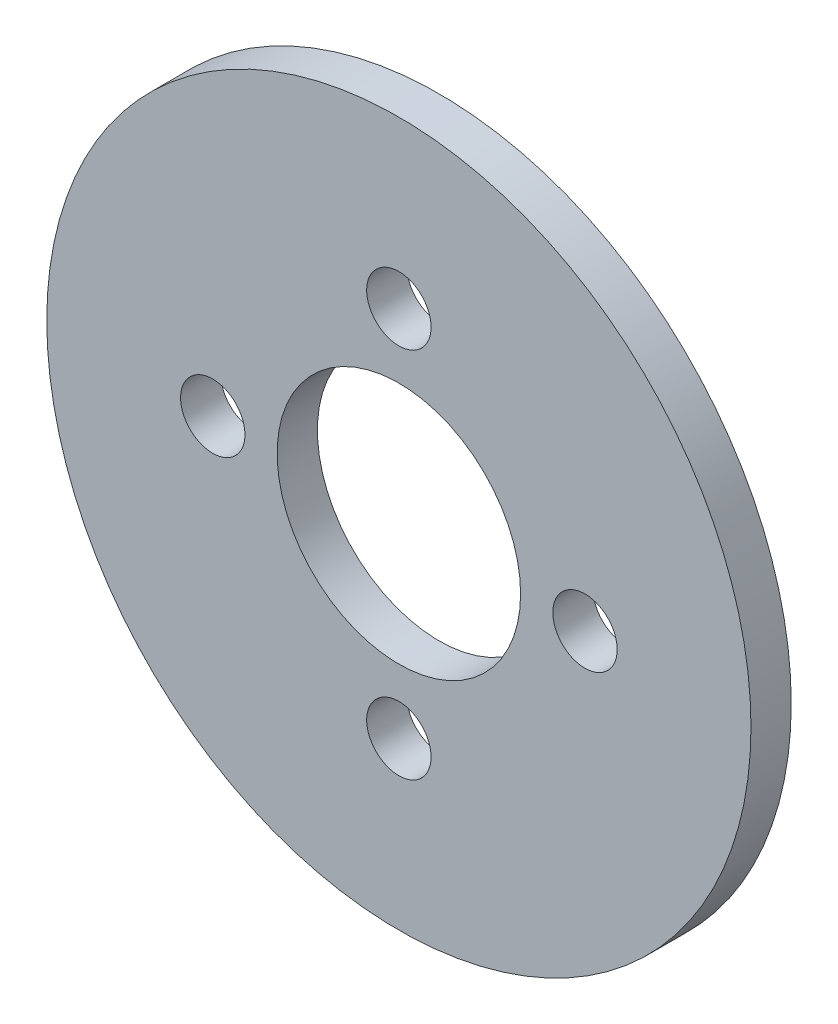
from build123d import *

# Parameters (mm, degrees)
SKETCH_1_R      = 17.5
SKETCH_1_R_2    = 1.6
SKETCH_1_R_3    = 6.05
EXTRUDE_1_DEPTH = 2


with BuildPart() as part:
    # ｽｹｯﾁ1 → ﾎﾞｽ - 押し出し1 (new body)
    with BuildSketch(Plane.XY):
        Circle(SKETCH_1_R)
        with Locations((0, 9.25)):
            Circle(SKETCH_1_R_2, mode=Mode.SUBTRACT)
        with Locations((9.25, 0)):
            Circle(SKETCH_1_R_2, mode=Mode.SUBTRACT)
        with Locations((-9.25, 0)):
            Circle(SKETCH_1_R_2, mode=Mode.SUBTRACT)
        with Locations((0, -9.25)):
            Circle(SKETCH_1_R_2, mode=Mode.SUBTRACT)
        Circle(SKETCH_1_R_3, mode=Mode.SUBTRACT)
    extrude(amount=EXTRUDE_1_DEPTH)


solid = part.part
